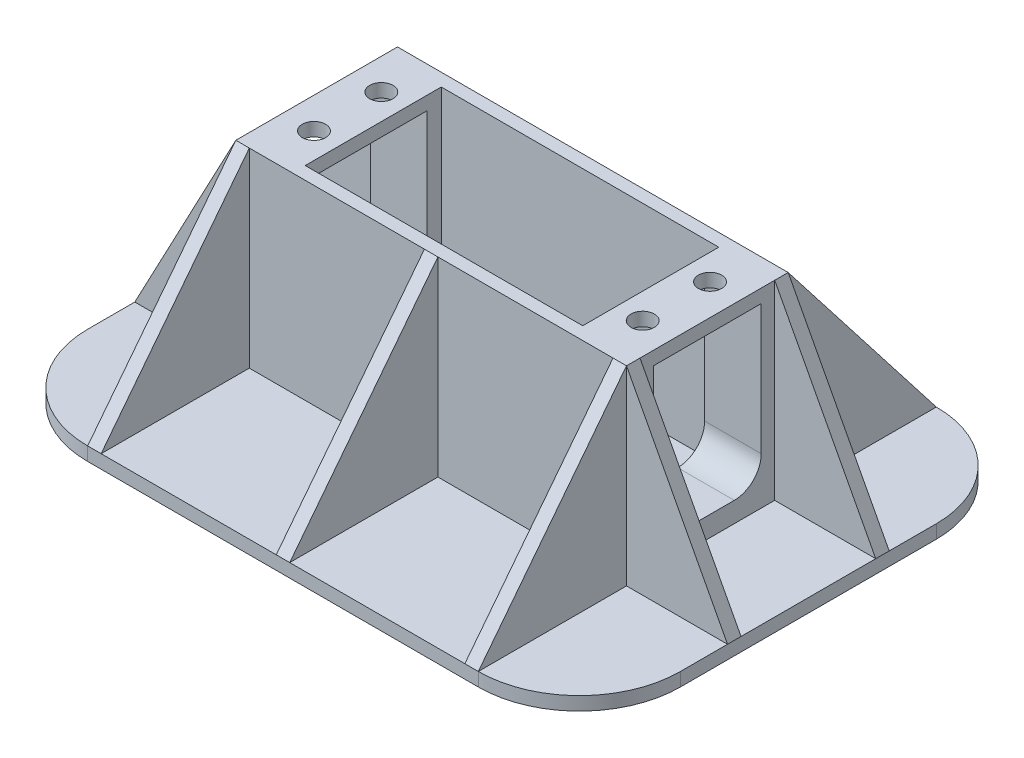
from build123d import *

# Parameters (mm, degrees)
SKETCH1_W                 = 58
SKETCH1_H                 = 24
BOSS_EXTRUDE1_DEPTH       = 28.3
SKETCH2_W                 = 88
SKETCH2_H                 = 68
BOSS_EXTRUDE2_DEPTH       = 2
SKETCH12_W                = 41.2
SKETCH12_H                = 20.2
CUT_EXTRUDE1_DEPTH        = 27.95
BOSS_EXTRUDE6_DEPTH       = 2
LPATTERN2_COUNT           = 3
LPATTERN2_PITCH           = 28
BOSS_EXTRUDE7_DEPTH       = 2
LPATTERN3_COUNT           = 2
LPATTERN3_PITCH           = 22
SKETCH17_R                = 1
CUT_EXTRUDE2_DEPTH        = 10
F_8_32_TAPPED_HOLE1_D     = 3.4544
F_8_32_TAPPED_HOLE1_DEPTH = 12
F_8_32_TAPPED_HOLE1_TIP   = 1.037806461
FILLET1_R                 = 15
FILLET2_R                 = 15
FILLET3_R                 = 15
FILLET5_R                 = 15
SKETCH20_W                = 16
SKETCH20_H                = 23.3
CUT_EXTRUDE3_DEPTH        = 10
SKETCH21_W                = 16
SKETCH21_H                = 23.3
CUT_EXTRUDE4_DEPTH        = 10
FILLET6_R                 = 4
FILLET7_R                 = 4
FILLET8_R                 = 4
FILLET9_R                 = 4


with BuildPart() as part:
    # Sketch1 → Boss-Extrude1 (new body)
    with BuildSketch(Plane(origin=(0, 0, 0), x_dir=(1, 0, 0), z_dir=(0, 1, 0))):
        Rectangle(SKETCH1_W, SKETCH1_H)
    extrude(amount=BOSS_EXTRUDE1_DEPTH)

    # Sketch2 → Boss-Extrude2 (add)
    with BuildSketch(Plane.XZ):
        Rectangle(SKETCH2_W, SKETCH2_H)
    extrude(amount=BOSS_EXTRUDE2_DEPTH)

    # Sketch12 → Cut-Extrude1 (cut)
    with BuildSketch(Plane(origin=(0, 28.3, 0), x_dir=(1, 0, 0), z_dir=(0, 1, 0))):
        Rectangle(SKETCH12_W, SKETCH12_H)
    extrude(amount=-CUT_EXTRUDE1_DEPTH, mode=Mode.SUBTRACT)

    # Sketch14 → Boss-Extrude6 (add)
    with BuildSketch(Plane.ZY.offset(29)):
        Polygon((-12, 28.3), (-12, 0), (-34, 0), align=None)
        Polygon((12, 28.3), (12, 0), (34, 0), align=None)
    boss_extrude6 = extrude(amount=-BOSS_EXTRUDE6_DEPTH)

    # LPattern2: Boss-Extrude6 ×3
    with Locations(*[(i * LPATTERN2_PITCH, 0, 0) for i in range(1, LPATTERN2_COUNT)]):
        add(boss_extrude6)

    # Sketch16 → Boss-Extrude7 (add)
    with BuildSketch(Plane(origin=(0, 0, -12), x_dir=(-1, 0, 0), z_dir=(0, 0, -1))):
        Polygon((-29, 28.3), (-44, 0), (-29, 0), align=None)
        Polygon((29, 28.3), (29, 0), (44, 0), align=None)
    boss_extrude7 = extrude(amount=-BOSS_EXTRUDE7_DEPTH)

    # LPattern3: Boss-Extrude7 ×2
    with Locations(*[(0, 0, i * LPATTERN3_PITCH) for i in range(1, LPATTERN3_COUNT)]):
        add(boss_extrude7)

    # Sketch17 → Cut-Extrude2 (cut)
    with BuildSketch(Plane(origin=(0, 28.3, 0), x_dir=(1, 0, 0), z_dir=(0, 1, 0))):
        with Locations(Location((-24.4, 5, 0), (0, 0, 270))):
            Circle(SKETCH17_R)
        with Locations(Location((-24.4, -5, 0), (0, 0, 270))):
            Circle(SKETCH17_R)
        with Locations(Location((24.4, -5, 0), (0, 0, 270))):
            Circle(SKETCH17_R)
        with Locations(Location((24.4, 5, 0), (0, 0, 270))):
            Circle(SKETCH17_R)
    extrude(amount=-CUT_EXTRUDE2_DEPTH, mode=Mode.SUBTRACT)

    # #8-32 Tapped Hole1
    with Locations(Plane(origin=(-24.4, 28.3, -5), x_dir=(0, 0, 1), z_dir=(0, 1, 0))):
        with Locations((0, 0), (10, 0), (0, 48.8), (10, 48.8)):
            Hole(F_8_32_TAPPED_HOLE1_D / 2, depth=F_8_32_TAPPED_HOLE1_DEPTH)
            with Locations((0, 0, -(F_8_32_TAPPED_HOLE1_DEPTH + F_8_32_TAPPED_HOLE1_TIP / 2))):  # 118° drill point
                Cone(0, F_8_32_TAPPED_HOLE1_D / 2, F_8_32_TAPPED_HOLE1_TIP, mode=Mode.SUBTRACT)

    # Fillet1
    fillet1_edges = [part.edges().sort_by_distance(p)[0] for p in [
        (-44, -1, 34),
    ]]
    fillet(fillet1_edges, radius=FILLET1_R)

    # Fillet2
    fillet2_edges = [part.edges().sort_by_distance(p)[0] for p in [
        (44, -1, 34),
    ]]
    fillet(fillet2_edges, radius=FILLET2_R)

    # Fillet3
    fillet3_edges = [part.edges().sort_by_distance(p)[0] for p in [
        (44, -1, -34),
    ]]
    fillet(fillet3_edges, radius=FILLET3_R)

    # Fillet5
    fillet5_edges = [part.edges().sort_by_distance(p)[0] for p in [
        (-44, -1, -34),
    ]]
    fillet(fillet5_edges, radius=FILLET5_R)

    # Sketch20 → Cut-Extrude3 (cut)
    with BuildSketch(Plane.ZY.offset(29)):
        with Locations((0, 14.65)):
            Rectangle(SKETCH20_W, SKETCH20_H)
    extrude(amount=-CUT_EXTRUDE3_DEPTH, mode=Mode.SUBTRACT)

    # Sketch21 → Cut-Extrude4 (cut)
    with BuildSketch(Plane(origin=(29, 0, 0), x_dir=(0, 0, -1), z_dir=(1, 0, 0))):
        with Locations((0, 14.65)):
            Rectangle(SKETCH21_W, SKETCH21_H)
    extrude(amount=-CUT_EXTRUDE4_DEPTH, mode=Mode.SUBTRACT)

    # Fillet6
    fillet6_edges = [part.edges().sort_by_distance(p)[0] for p in [
        (24.8, 3, 8),
    ]]
    fillet(fillet6_edges, radius=FILLET6_R)

    # Fillet7
    fillet7_edges = [part.edges().sort_by_distance(p)[0] for p in [
        (24.8, 3, -8),
    ]]
    fillet(fillet7_edges, radius=FILLET7_R)

    # Fillet8
    fillet8_edges = [part.edges().sort_by_distance(p)[0] for p in [
        (-24.8, 3, -8),
    ]]
    fillet(fillet8_edges, radius=FILLET8_R)

    # Fillet9
    fillet9_edges = [part.edges().sort_by_distance(p)[0] for p in [
        (-24.8, 3, 8),
    ]]
    fillet(fillet9_edges, radius=FILLET9_R)


solid = part.part
